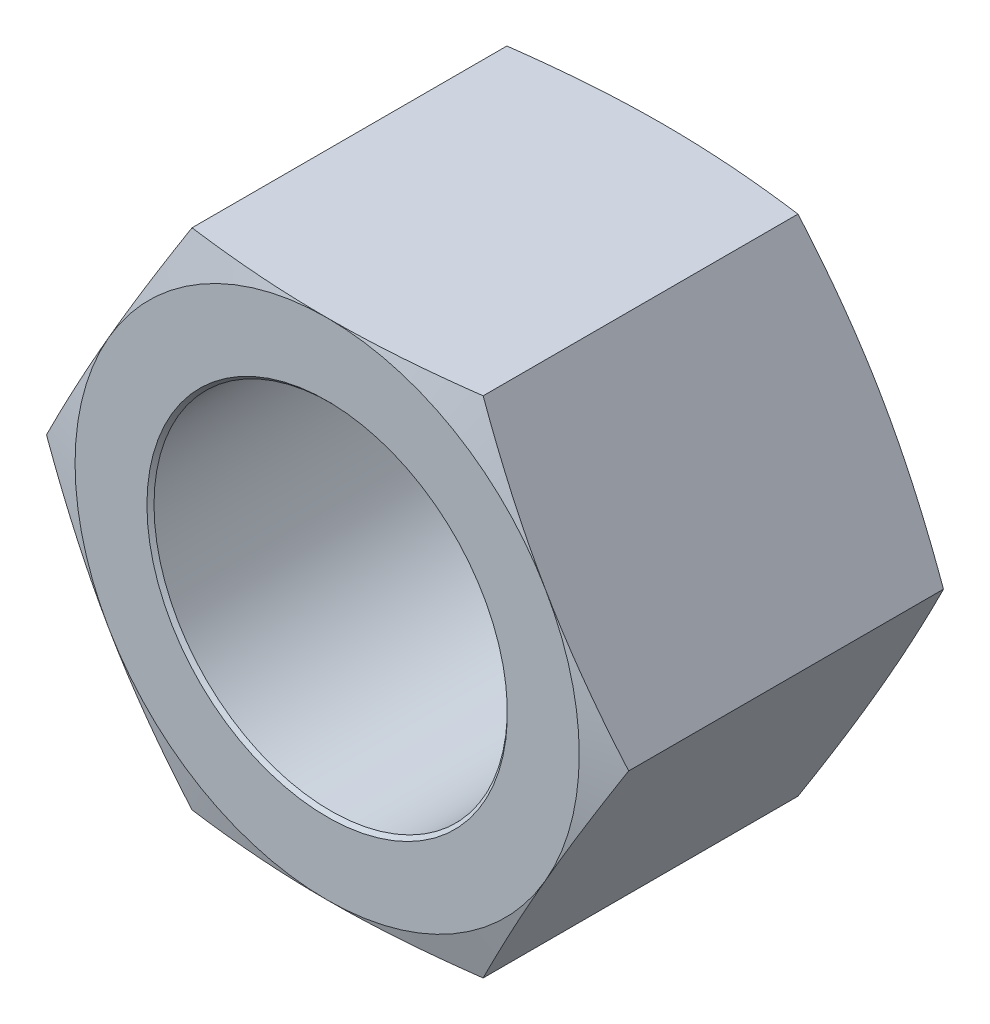
from build123d import *

# Parameters (mm, degrees)
SKETCH_1_R          = 10
EXTRUDE_522_DEPTH   = 19
SKETCH_2_OUTSIDE_W  = 328.096
SKETCH_2_OUTSIDE_H  = 323.682
SKETCH_2_OUTSIDE_R  = 14.267768527
CUT_EXTRUDE_1_DEPTH = 38
CUT_EXTRUDE_1_DRAFT = -75
SKETCH_3_OUTSIDE_W  = 328.096
SKETCH_3_OUTSIDE_H  = 323.682
SKETCH_3_OUTSIDE_R  = 14.267768527
CUT_EXTRUDE_2_DEPTH = 38
CUT_EXTRUDE_2_DRAFT = -75
CHAMFER_1_SIZE      = 0.2


with BuildPart() as part:
    # 草图1 → Extrude 522 (new body)
    with BuildSketch(Plane.XY):
        Polygon((8.2375, 14.267768527), (-8.2375, 14.267768527), (-16.475, 0), (-8.2375, -14.267768527), (8.2375, -14.267768527), (16.475, 0), align=None)
        Circle(SKETCH_1_R, mode=Mode.SUBTRACT)
    extrude(amount=EXTRUDE_522_DEPTH)


with BuildPart() as cut_extrude_1_tool:
    # 草图2 outside → 切除-拉伸1 (with draft: the straight prism first)
    with BuildSketch(Plane(origin=(0, 0, 0), x_dir=(-1, 0, 0), z_dir=(0, 0, -1))):
        Rectangle(SKETCH_2_OUTSIDE_W, SKETCH_2_OUTSIDE_H)
        Circle(SKETCH_2_OUTSIDE_R, mode=Mode.SUBTRACT)
    extrude(amount=-CUT_EXTRUDE_1_DEPTH)
    # 切除-拉伸1: the draft: its side faces are tilted about the plane it starts from
    cut_extrude_1_sides = [cut_extrude_1_tool.faces().sort_by_distance(p)[0] for p in [
        (0, -161.841, 19),
        (-164.048, 0, 19),
        (0, 161.841, 19),
        (164.048, 0, 19),
        (14.267768527, 0, 19),
    ]]
    draft(cut_extrude_1_sides, Plane(origin=(0, 0, 0), x_dir=(-1, 0, 0), z_dir=(0, 0, -1)), CUT_EXTRUDE_1_DRAFT)


with BuildPart() as part_1:
    add(part.part)

    # 切除-拉伸1: cut by cut_extrude_1_tool
    add(cut_extrude_1_tool.part, mode=Mode.SUBTRACT)


with BuildPart() as cut_extrude_2_tool:
    # 草图3 outside → 切除-拉伸2 (with draft: the straight prism first)
    with BuildSketch(Plane.XY.offset(19)):
        Rectangle(SKETCH_3_OUTSIDE_W, SKETCH_3_OUTSIDE_H)
        Circle(SKETCH_3_OUTSIDE_R, mode=Mode.SUBTRACT)
    extrude(amount=-CUT_EXTRUDE_2_DEPTH)
    # 切除-拉伸2: the draft: its side faces are tilted about the plane it starts from
    cut_extrude_2_sides = [cut_extrude_2_tool.faces().sort_by_distance(p)[0] for p in [
        (0, -161.841, 0),
        (164.048, 0, 0),
        (0, 161.841, 0),
        (-164.048, 0, 0),
        (-14.267768527, 0, 0),
    ]]
    draft(cut_extrude_2_sides, Plane.XY.offset(19), CUT_EXTRUDE_2_DRAFT)


with BuildPart() as part_2:
    add(part_1.part)

    # 切除-拉伸2: cut by cut_extrude_2_tool
    add(cut_extrude_2_tool.part, mode=Mode.SUBTRACT)

    # 倒角1
    chamfer_1_edges = [part_2.edges().sort_by_distance(p)[0] for p in [
        (-10, 0, 0),
        (-10, 0, 19),
    ]]
    chamfer(chamfer_1_edges, length=CHAMFER_1_SIZE)


solid = part_2.part
